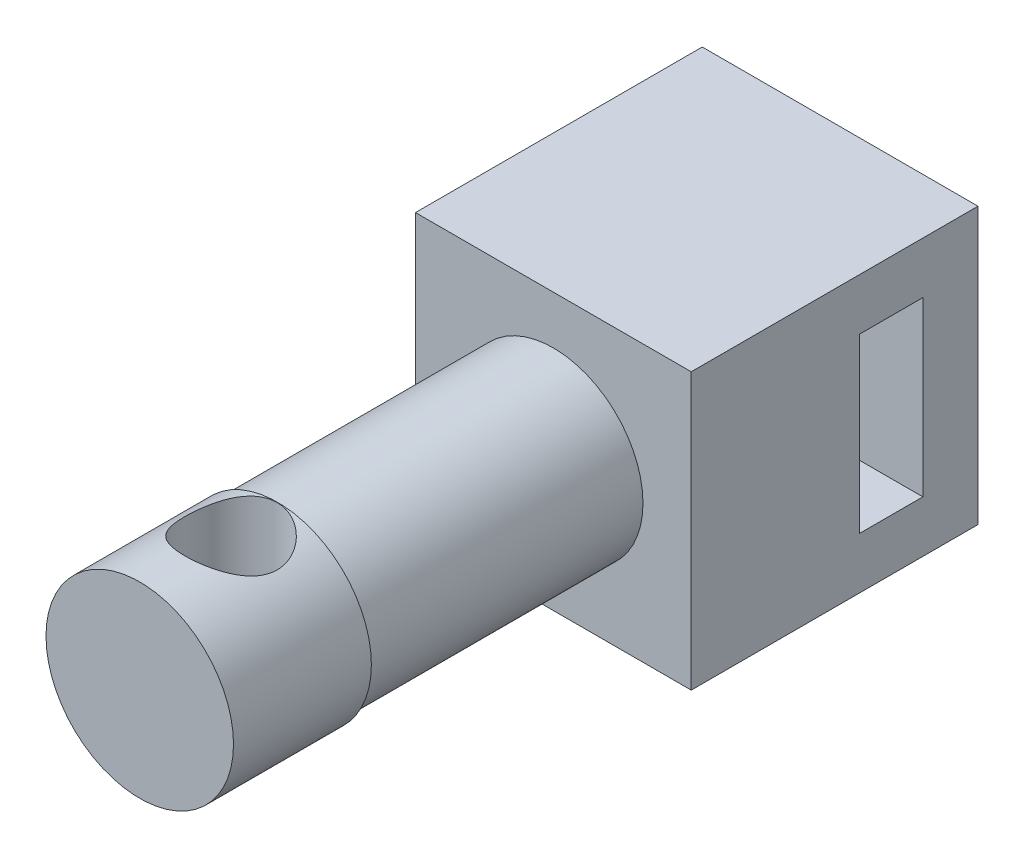
from build123d import *

# Parameters (mm, degrees)
SKETCH1_W               = 10
SKETCH1_H               = 10
BOSS_EXTRUDE1_DEPTH     = 5
CUT_EXTRUDE1_DEPTH      = 9.660254038
CUT_EXTRUDE1_DEPTH_BACK = 9.660254038
SKETCH2_R               = 1.675
SKETCH3_R               = 1.675
CUT_EXTRUDE3_DEPTH      = 2.3
SKETCH4_W               = 10
SKETCH4_H               = 10
BOSS_EXTRUDE2_DEPTH     = 2.7
SKETCH6_W               = 10
SKETCH6_H               = 10
BOSS_EXTRUDE3_DEPTH     = 7
SKETCH9_R               = 2.15
CUT_EXTRUDE12_DEPTH     = 19.468622038
SKETCH10_R              = 1.675
CUT_EXTRUDE13_DEPTH     = 13.003749414
BOSS_EXTRUDE4_DEPTH     = 2.3
SKETCH12_W              = 10
SKETCH12_H              = 10
BOSS_EXTRUDE5_DEPTH     = 2.7
CUT_EXTRUDE14_START     = -2.7
SKETCH13_R              = 1.675
CUT_EXTRUDE14_DEPTH     = 2.7
SKETCH14_R              = 2.15
BOSS_EXTRUDE6_DEPTH     = 0.76
SKETCH16_W              = 10
SKETCH16_H              = 19.7
CUT_EXTRUDE15_DEPTH     = 2.29
BOSS_EXTRUDE7_START     = 1
SKETCH17_W              = 10
SKETCH17_H              = 7.71
SKETCH17_R              = 1.675
BOSS_EXTRUDE7_DEPTH     = 1
SKETCH18_W              = 10
SKETCH18_H              = 7.71
SKETCH18_R              = 1.675
BOSS_EXTRUDE9_DEPTH     = 1
BOSS_EXTRUDE13_DEPTH    = 2.3
SKETCH23_W              = 10
SKETCH23_H              = 10
SKETCH23_R              = 1.675
BOSS_EXTRUDE15_DEPTH    = 2
SKETCH24_W              = 10
SKETCH24_H              = 5.85
CUT_EXTRUDE16_DEPTH     = 25.448519432
SKETCH25_W              = 10
SKETCH25_H              = 10
BOSS_EXTRUDE16_DEPTH    = 6
SKETCH26_W              = 10
SKETCH26_H              = 10
CUT_EXTRUDE17_DEPTH     = 7.71
SKETCH27_W              = 10
SKETCH27_H              = 10
BOSS_EXTRUDE17_DEPTH    = 6.1
SKETCH28_R              = 3.25
BOSS_EXTRUDE18_DEPTH    = 10
SKETCH29_R              = 1.625
CUT_EXTRUDE18_DEPTH     = 2.7
SKETCH33_W              = 6.8
SKETCH33_H              = 6.8
BOSS_EXTRUDE19_DEPTH    = 5
SKETCH36_R              = 1.675
CUT_EXTRUDE22_DEPTH     = 10
CUT_EXTRUDE23_DEPTH     = 10


with BuildPart() as part:
    # Sketch1 → Boss-Extrude1 (new body)
    with BuildSketch(Plane(origin=(0, 0, 0), x_dir=(1, 0, 0), z_dir=(0, 1, 0))):
        Rectangle(SKETCH1_W, SKETCH1_H)
    extrude(amount=BOSS_EXTRUDE1_DEPTH)

    # Sketch2 → Cut-Extrude1 (cut, two sides: drawn at the far end of the back side and taken through both)
    with BuildSketch(Plane(origin=(0, 5, 0), x_dir=(1, 0, 0), z_dir=(0, 1, 0)).offset(-CUT_EXTRUDE1_DEPTH_BACK)):
        with Locations(Location((0, 0, 0), (0, 0, 270))):
            Circle(SKETCH2_R)
    extrude(amount=CUT_EXTRUDE1_DEPTH + CUT_EXTRUDE1_DEPTH_BACK, mode=Mode.SUBTRACT)

    # Sketch3 → Cut-Extrude3 (cut)
    # profile 1 of 2: a face of its own
    with BuildSketch(Plane(origin=(0, 5, 0), x_dir=(1, 0, 0), z_dir=(0, 1, 0))):
        Polygon((-1.56461923, -2.71), (1.56461923, -2.71), (3.129238459, 0), (1.56461923, 2.71), (-1.56461923, 2.71), (-3.129238459, 0), align=None)
        with Locations(Location((0, 0, 0), (0, 0, 270))):
            Circle(SKETCH3_R, mode=Mode.SUBTRACT)
    # profile 2 of 2: a face of its own
    with BuildSketch(Plane(origin=(0, 5, 0), x_dir=(1, 0, 0), z_dir=(0, 1, 0))):
        Polygon((-1.56461923, -2.71), (-3.129238459, 0), (-3.129238459, -5), (3.129238459, -5), (3.129238459, 0), (1.56461923, -2.71), align=None)
    extrude(amount=-CUT_EXTRUDE3_DEPTH, mode=Mode.SUBTRACT)

    # Sketch4 → Boss-Extrude2 (add)
    with BuildSketch(Plane(origin=(0, 5, 0), x_dir=(1, 0, 0), z_dir=(0, 1, 0))):
        Rectangle(SKETCH4_W, SKETCH4_H)
    extrude(amount=BOSS_EXTRUDE2_DEPTH)

    # Sketch6 → Boss-Extrude3 (add)
    with BuildSketch(Plane(origin=(0, 7.7, 0), x_dir=(1, 0, 0), z_dir=(0, 1, 0))):
        Rectangle(SKETCH6_W, SKETCH6_H)
    extrude(amount=BOSS_EXTRUDE3_DEPTH)

    # Sketch9 → Cut-Extrude12 (cut, through all)
    with BuildSketch(Plane(origin=(0, 0, -5), x_dir=(-1, 0, 0), z_dir=(0, 0, -1))):
        with Locations((0, 9.85)):
            Circle(SKETCH9_R)
    extrude(amount=-CUT_EXTRUDE12_DEPTH, mode=Mode.SUBTRACT)

    # Sketch10 → Cut-Extrude13 (cut, through all)
    with BuildSketch(Plane.XZ.offset(-5)):
        with Locations(Location((0, 0, 0), (0, 0, 90))):
            Circle(SKETCH10_R)
    extrude(amount=-CUT_EXTRUDE13_DEPTH, mode=Mode.SUBTRACT)

    # Sketch11 → Boss-Extrude4 (add)
    with BuildSketch(Plane(origin=(0, 14.7, 0), x_dir=(1, 0, 0), z_dir=(0, 1, 0))):
        Polygon((1.56461923, 2.71), (3.129238459, 0), (3.129238459, -5), (5, -5), (5, 5), (-5, 5), (-5, -5), (-3.129238459, -5), (-3.129238459, 0), (-1.56461923, 2.71), align=None)
    extrude(amount=BOSS_EXTRUDE4_DEPTH)

    # Sketch12 → Boss-Extrude5 (add)
    with BuildSketch(Plane(origin=(0, 17, 0), x_dir=(1, 0, 0), z_dir=(0, 1, 0))):
        Rectangle(SKETCH12_W, SKETCH12_H)
    extrude(amount=BOSS_EXTRUDE5_DEPTH)

    # Sketch13 → Cut-Extrude14 (cut)
    with BuildSketch(Plane(origin=(0, 19.7, 0), x_dir=(1, 0, 0), z_dir=(0, 1, 0)).offset(CUT_EXTRUDE14_START)):
        with Locations(Location((0, 0, 0), (0, 0, 270))):
            Circle(SKETCH13_R)
    extrude(amount=CUT_EXTRUDE14_DEPTH, mode=Mode.SUBTRACT)

    # Sketch16 → Cut-Extrude15 (cut)
    with BuildSketch(Plane.XY.offset(5)):
        with Locations((0, 9.85)):
            Rectangle(SKETCH16_W, SKETCH16_H)
    extrude(amount=-CUT_EXTRUDE15_DEPTH, mode=Mode.SUBTRACT)

    # Sketch17 → Boss-Extrude7 (add)
    with BuildSketch(Plane(origin=(0, 0, 0), x_dir=(-1, 0, 0), z_dir=(0, -1, 0)).offset(BOSS_EXTRUDE7_START)):
        with Locations((0, 1.145)):
            Rectangle(SKETCH17_W, SKETCH17_H)
        with Locations(Location((0, 0, 0), (0, 0, 270))):
            Circle(SKETCH17_R, mode=Mode.SUBTRACT)
    extrude(amount=-BOSS_EXTRUDE7_DEPTH)

    # Sketch18 → Boss-Extrude9 (add)
    with BuildSketch(Plane(origin=(0, 19.7, 0), x_dir=(1, 0, 0), z_dir=(0, 1, 0))):
        with Locations((0, 1.145)):
            Rectangle(SKETCH18_W, SKETCH18_H)
        with Locations(Location((0, 0, 0), (0, 0, 270))):
            Circle(SKETCH18_R, mode=Mode.SUBTRACT)
    extrude(amount=BOSS_EXTRUDE9_DEPTH)


with BuildPart() as body_2:
    # Sketch14 → Boss-Extrude6 (new body)
    with BuildSketch(Plane(origin=(0, 0, -5), x_dir=(-1, 0, 0), z_dir=(0, 0, -1))):
        with Locations((0, 9.85)):
            Circle(SKETCH14_R)
    extrude(amount=-BOSS_EXTRUDE6_DEPTH)


    add(part.part)  # Boss-Extrude13 merges part
    # Sketch22 → Boss-Extrude13 (add)
    with BuildSketch(Plane(origin=(0, 0, -5), x_dir=(-1, 0, 0), z_dir=(0, 0, -1))):
        Polygon((-5, 12.979238459), (0, 12.979238459), (2.71, 11.41461923), (2.71, 8.28538077), (0, 6.720761541), (-5, 6.720761541), (-5, 4.85), (5, 4.85), (5, 14.85), (-5, 14.85), align=None)
    extrude(amount=BOSS_EXTRUDE13_DEPTH)

    # Sketch23 → Boss-Extrude15 (add)
    with BuildSketch(Plane(origin=(0, 0, -7.3), x_dir=(-1, 0, 0), z_dir=(0, 0, -1))):
        with Locations((0, 9.85)):
            Rectangle(SKETCH23_W, SKETCH23_H)
        with Locations((0, 9.85)):
            Circle(SKETCH23_R, mode=Mode.SUBTRACT)
    extrude(amount=BOSS_EXTRUDE15_DEPTH)

    # Sketch24 → Cut-Extrude16 (cut, through all)
    with BuildSketch(Plane(origin=(0, 0, -9.3), x_dir=(-1, 0, 0), z_dir=(0, 0, -1))):
        with Locations((0, 17.775)):
            Rectangle(SKETCH24_W, SKETCH24_H)
        with Locations((0, 1.925)):
            Rectangle(SKETCH24_W, SKETCH24_H)
    extrude(amount=-CUT_EXTRUDE16_DEPTH, mode=Mode.SUBTRACT)

    # Sketch25 → Boss-Extrude16 (add)
    with BuildSketch(Plane.XY.offset(2.71)):
        with Locations((0, 9.85)):
            Rectangle(SKETCH25_W, SKETCH25_H)
    extrude(amount=-BOSS_EXTRUDE16_DEPTH)

    # Sketch26 → Cut-Extrude17 (cut)
    with BuildSketch(Plane.XY.offset(2.71)):
        with Locations((0, 9.85)):
            Rectangle(SKETCH26_W, SKETCH26_H)
    extrude(amount=-CUT_EXTRUDE17_DEPTH, mode=Mode.SUBTRACT)

    # Sketch27 → Boss-Extrude17 (add)
    with BuildSketch(Plane.XY.offset(-5)):
        with Locations((0, 9.85)):
            Rectangle(SKETCH27_W, SKETCH27_H)
    extrude(amount=BOSS_EXTRUDE17_DEPTH)

    # Sketch28 → Boss-Extrude18 (add)
    with BuildSketch(Plane.XY.offset(1.1)):
        with Locations((0, 9.85)):
            Circle(SKETCH28_R)
    extrude(amount=BOSS_EXTRUDE18_DEPTH)

    # Sketch29 → Cut-Extrude18 (cut)
    with BuildSketch(Plane(origin=(0, 0, -5), x_dir=(-1, 0, 0), z_dir=(0, 0, -1))):
        with Locations((0, 9.85)):
            Circle(SKETCH29_R)
    extrude(amount=-CUT_EXTRUDE18_DEPTH, mode=Mode.SUBTRACT)

    # Sketch33 → Boss-Extrude19 (add)
    with BuildSketch(Plane.XY.offset(11.1)):
        with Locations((0, 9.85)):
            Rectangle(SKETCH33_W, SKETCH33_H)
    extrude(amount=BOSS_EXTRUDE19_DEPTH)

    # Sketch36 → Cut-Extrude22 (cut)
    with BuildSketch(Plane(origin=(0, 6.45, 0), x_dir=(-1, 0, 0), z_dir=(0, -1, 0))):
        with Locations(Location((0, -12.79, 0), (0, 0, 90))):
            Circle(SKETCH36_R)
    extrude(amount=-CUT_EXTRUDE22_DEPTH, mode=Mode.SUBTRACT)

    # Sketch37 → Cut-Extrude23 (cut)
    with BuildSketch(Plane.XY.offset(16.1)):
        with BuildLine():
            Line((0, 13.25), (-3.4, 13.25))
            Line((-3.4, 13.25), (-2.404163056, 12.254163056))
            ThreePointArc((-2.404163056, 12.254163056), (-1.30112367, 12.991190411), (0, 13.25))
        make_face()
        with BuildLine():
            Line((-2.404163056, 12.254163056), (-3.4, 13.25))
            Line((-3.4, 13.25), (-3.4, 9.85))
            ThreePointArc((-3.4, 9.85), (-3.141190411, 11.15112367), (-2.404163056, 12.254163056))
        make_face()
        with BuildLine():
            ThreePointArc((0, 6.45), (-2.404163056, 7.445836944), (-3.4, 9.85))
            Line((-3.4, 9.85), (-3.4, 6.45))
            Line((-3.4, 6.45), (0, 6.45))
        make_face()
        with BuildLine():
            Line((3.4, 6.45), (2.404163056, 7.445836944))
            ThreePointArc((2.404163056, 7.445836944), (1.30112367, 6.708809589), (0, 6.45))
            Line((0, 6.45), (3.4, 6.45))
        make_face()
        with BuildLine():
            ThreePointArc((3.4, 9.85), (3.141190411, 8.54887633), (2.404163056, 7.445836944))
            Line((2.404163056, 7.445836944), (3.4, 6.45))
            Line((3.4, 6.45), (3.4, 9.85))
        make_face()
        with BuildLine():
            Line((3.4, 13.25), (0, 13.25))
            ThreePointArc((0, 13.25), (2.404163056, 12.254163056), (3.4, 9.85))
            Line((3.4, 9.85), (3.4, 13.25))
        make_face()
    extrude(amount=-CUT_EXTRUDE23_DEPTH, mode=Mode.SUBTRACT)


solid = body_2.part
